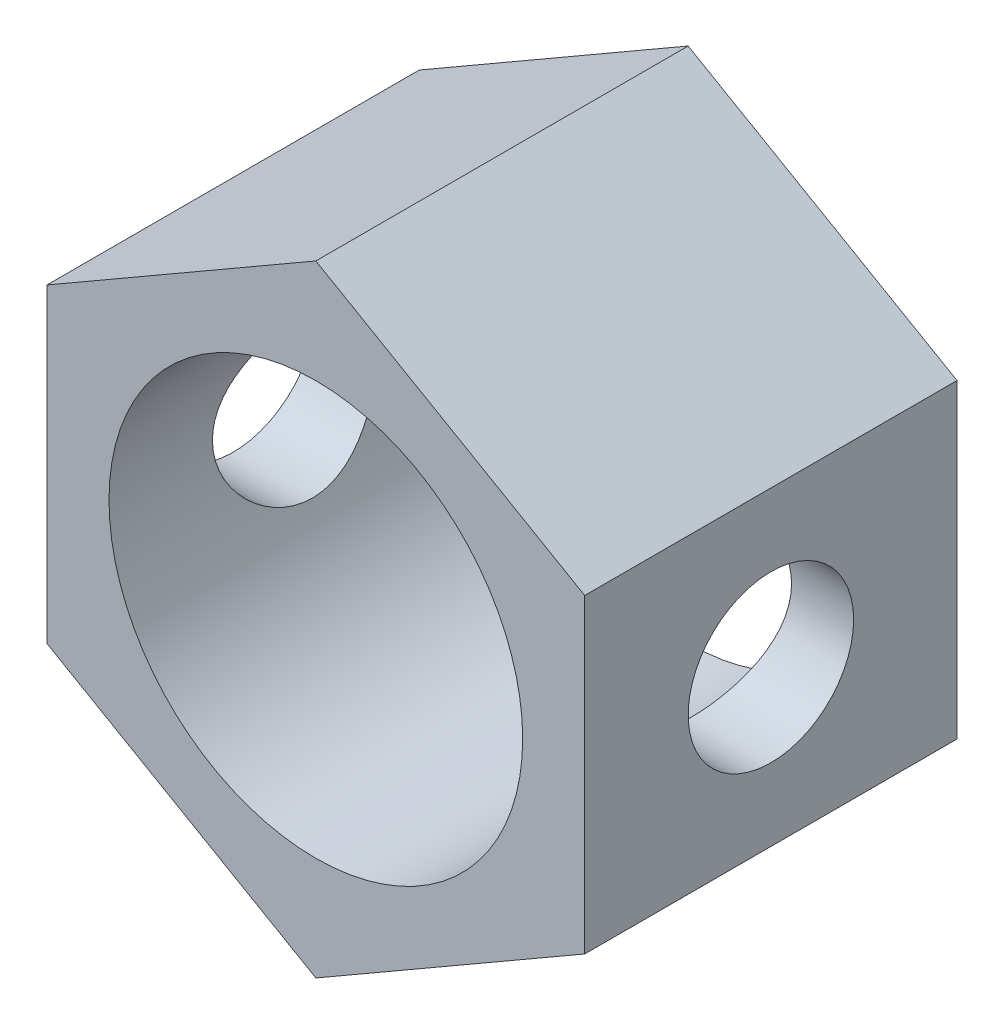
from build123d import *

# Parameters (mm, degrees)
SKETCH1_R           = 5
BOSS_EXTRUDE1_DEPTH = 9
SKETCH2_R           = 2
CUT_EXTRUDE1_DEPTH  = 20


with BuildPart() as part:
    # Sketch1 → Boss-Extrude1 (new body)
    with BuildSketch(Plane.XY):
        Polygon((-4.361896839, 16.037064841), (-4.361896839, 8.531511342), (-10.861896839, 4.778734592), (-17.361896839, 8.531511342), (-17.361896839, 16.037064841), (-10.861896839, 19.789841591), align=None)
        with Locations((-10.861896839, 12.284288091)):
            Circle(SKETCH1_R, mode=Mode.SUBTRACT)
    extrude(amount=BOSS_EXTRUDE1_DEPTH)

    # Sketch2 → Cut-Extrude1 (cut)
    with BuildSketch(Plane(origin=(-4.361896839, 0, 0), x_dir=(0, 0, -1), z_dir=(1, 0, 0))):
        with Locations((-4.5, 12.284288091)):
            Circle(SKETCH2_R)
    extrude(amount=-CUT_EXTRUDE1_DEPTH, mode=Mode.SUBTRACT)


solid = part.part
